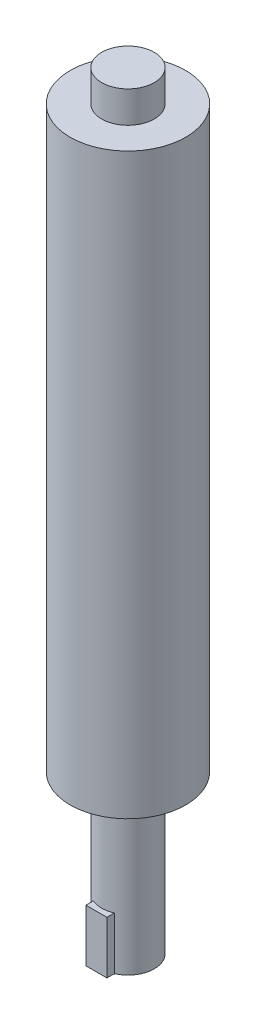
from build123d import *

# Parameters (mm, degrees)
SKETCH_1_R             = 2.5
EXTRUDE_1_DEPTH        = 30.5
SKETCH_2_R             = 5.5
EXTRUDE_2_DEPTH        = 27.5
SKETCH_3_R             = 2.5
EXTRUDE_3_DEPTH        = 12
SKETCH_4_W             = 2
SKETCH_4_H             = 1
EXTRUDE_4_DEPTH        = 5
HOLE_WIZARD_M4_1_D     = 3.3
HOLE_WIZARD_M4_1_DEPTH = 10.508579979
HOLE_WIZARD_M4_1_TIP   = 0.991420021


with BuildPart() as part:
    # 草图1 → 凸台-拉伸1 (new, symmetric)
    with BuildSketch(Plane(origin=(0, 0, 0), x_dir=(1, 0, 0), z_dir=(0, 1, 0))):
        with Locations(Location((0, 0, 0), (0, 0, 90))):
            Circle(SKETCH_1_R)
    extrude(amount=EXTRUDE_1_DEPTH, both=True)

    # 草图2 → 凸台-拉伸2 (add, symmetric)
    with BuildSketch(Plane(origin=(0, 0, 0), x_dir=(1, 0, 0), z_dir=(0, 1, 0))):
        with Locations(Location((0, 0, 0), (0, 0, 270))):
            Circle(SKETCH_2_R)
    extrude(amount=EXTRUDE_2_DEPTH, both=True)

    # 草图3 → 凸台-拉伸3 (add)
    with BuildSketch(Plane.XZ.offset(30.5)):
        with Locations(Location((0, 0, 0), (0, 0, 270))):
            Circle(SKETCH_3_R)
    extrude(amount=EXTRUDE_3_DEPTH)

    # 草图4 → 凸台-拉伸4 (add)
    with BuildSketch(Plane.XZ.offset(42.5)):
        with Locations((0, 2.5)):
            Rectangle(SKETCH_4_W, SKETCH_4_H)
    extrude(amount=-EXTRUDE_4_DEPTH)

    # M4 螺纹孔1
    with Locations(Plane(origin=(0, -42.5, 0), x_dir=(-1, 0, 0), z_dir=(0, -1, 0))):
        with Locations((0, 0)):
            Hole(HOLE_WIZARD_M4_1_D / 2, depth=HOLE_WIZARD_M4_1_DEPTH)
            with Locations((0, 0, -(HOLE_WIZARD_M4_1_DEPTH + HOLE_WIZARD_M4_1_TIP / 2))):  # 118° drill point
                Cone(0, HOLE_WIZARD_M4_1_D / 2, HOLE_WIZARD_M4_1_TIP, mode=Mode.SUBTRACT)


solid = part.part
